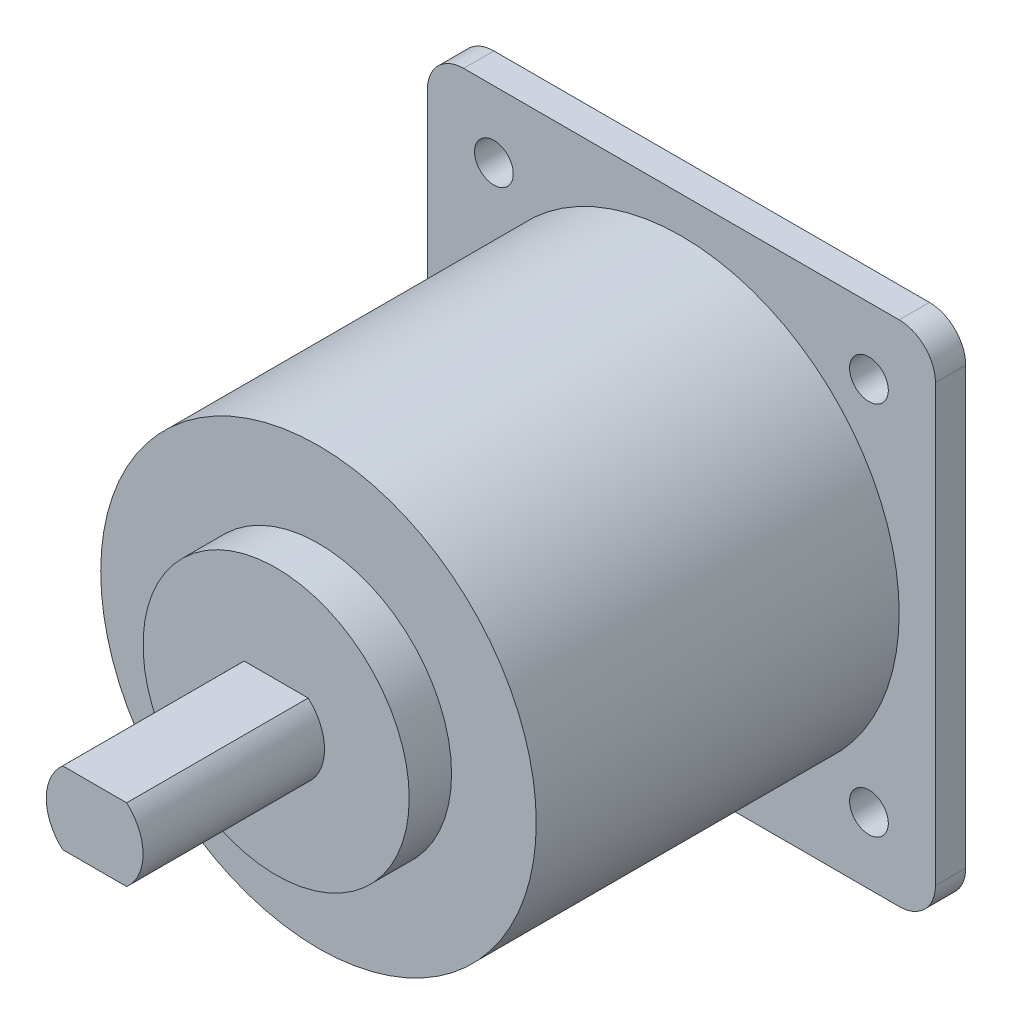
from build123d import *

# Parameters (mm, degrees)
SKETCH_1_R          = 18
EXTRUDE_1_DEPTH     = 32.5
SKETCH_1_3_W        = 42
SKETCH_1_3_H        = 42
SKETCH_1_3_R        = 18
EXTRUDE_2_DEPTH     = 2.5
FILLET_1_R          = 3
SKETCH_4_R          = 1.6
CUT_EXTRUDE_1_DEPTH = 2.5
SKETCH_5_R          = 11
EXTRUDE_3_DEPTH     = 3.5
EXTRUDE_4_DEPTH     = 15
SKETCH_7_R          = 11
CUT_EXTRUDE_2_DEPTH = 25


with BuildPart() as part:
    # 草图1 → 凸台-拉伸1 (new body)
    with BuildSketch(Plane.XY):
        Circle(SKETCH_1_R)
    extrude(amount=EXTRUDE_1_DEPTH)

    # 草图1<3> → 凸台-拉伸2 (add)
    with BuildSketch(Plane.XY):
        Rectangle(SKETCH_1_3_W, SKETCH_1_3_H)
        Circle(SKETCH_1_3_R, mode=Mode.SUBTRACT)
    extrude(amount=EXTRUDE_2_DEPTH)

    # 圆角1
    fillet_1_edges = [part.edges().sort_by_distance(p)[0] for p in [
        (21, -21, 1.25),
        (-21, -21, 1.25),
        (-21, 21, 1.25),
        (21, 21, 1.25),
    ]]
    fillet(fillet_1_edges, radius=FILLET_1_R)

    # 草图4 → 切除-拉伸1 (cut)
    with BuildSketch(Plane(origin=(0, 0, 0), x_dir=(-1, 0, 0), z_dir=(0, 0, -1))):
        with Locations((-15.5, 15.5)):
            Circle(SKETCH_4_R)
        with Locations((-15.5, -15.5)):
            Circle(SKETCH_4_R)
        with Locations((15.5, -15.5)):
            Circle(SKETCH_4_R)
        with Locations((15.5, 15.5)):
            Circle(SKETCH_4_R)
    extrude(amount=-CUT_EXTRUDE_1_DEPTH, mode=Mode.SUBTRACT)

    # 草图5 → 凸台-拉伸3 (add)
    with BuildSketch(Plane.XY.offset(32.5)):
        Circle(SKETCH_5_R)
    extrude(amount=EXTRUDE_3_DEPTH)

    # 草图6 → 凸台-拉伸4 (add)
    with BuildSketch(Plane.XY.offset(36)):
        with BuildLine():
            Line((-2.645751311, -3), (2.645751311, -3))
            ThreePointArc((2.645751311, -3), (4, 0), (2.645751311, 3))
            Line((2.645751311, 3), (-2.645751311, 3))
            ThreePointArc((-2.645751311, 3), (-4, 0), (-2.645751311, -3))
        make_face()
    extrude(amount=EXTRUDE_4_DEPTH)

    # 草图7 → 切除-拉伸2 (cut)
    with BuildSketch(Plane(origin=(0, 0, 0), x_dir=(-1, 0, 0), z_dir=(0, 0, -1))):
        Circle(SKETCH_7_R)
    extrude(amount=-CUT_EXTRUDE_2_DEPTH, mode=Mode.SUBTRACT)


solid = part.part
